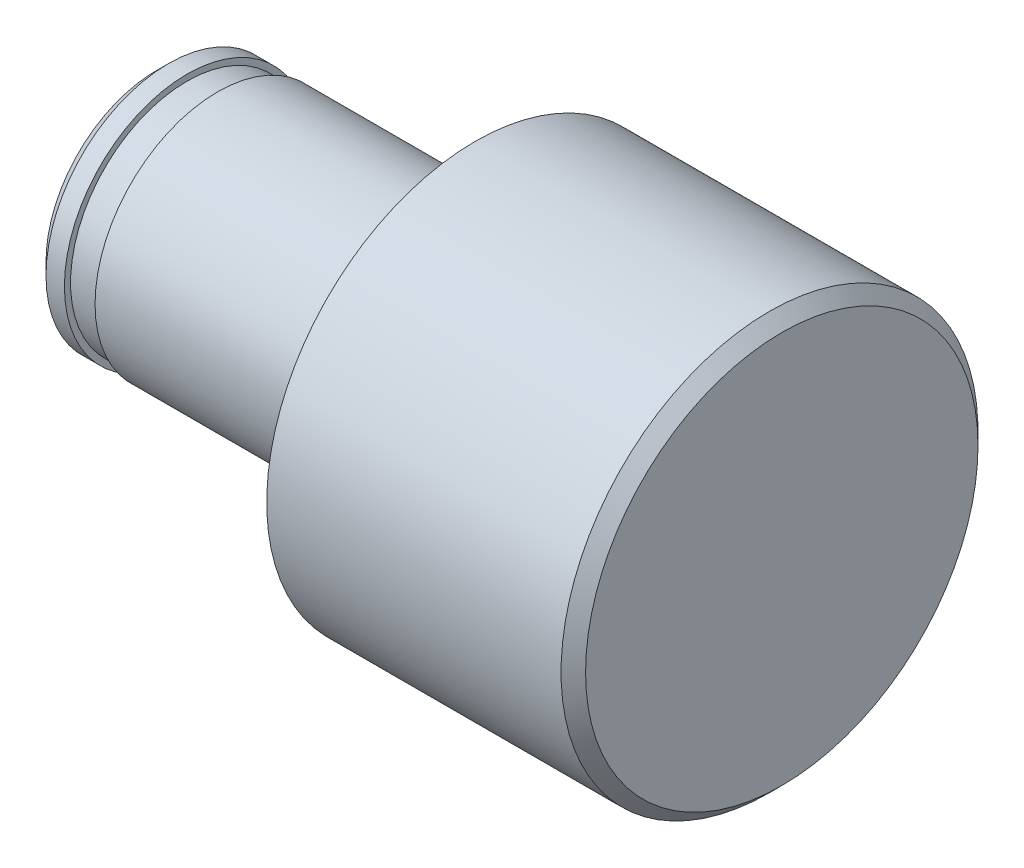
from build123d import *

# Parameters (mm, degrees)
FASE1_SIZE = 0.2


with BuildPart() as part:
    # Skizze2 → Rotation1 (revolve)
    with BuildSketch(Plane.XY):
        Polygon((3.956451613, 0), (-6.243548387, 0), (-6.243548387, 2), (-5.743548387, 2), (-5.743548387, 1.9), (-5.243548387, 1.9), (-5.243548387, 2), (-1.043548387, 2), (-1.043548387, 3.4), (3.956451613, 3.4), align=None)
    revolve(axis=Axis((3.956451613, 0, 0), (-1, 0, 0)))

    # Fase1
    fase1_edges = [part.edges().sort_by_distance(p)[0] for p in [
        (-6.243548387, -2, 0),
        (3.956451613, -3.4, 0),
    ]]
    chamfer(fase1_edges, length=FASE1_SIZE)


solid = part.part
